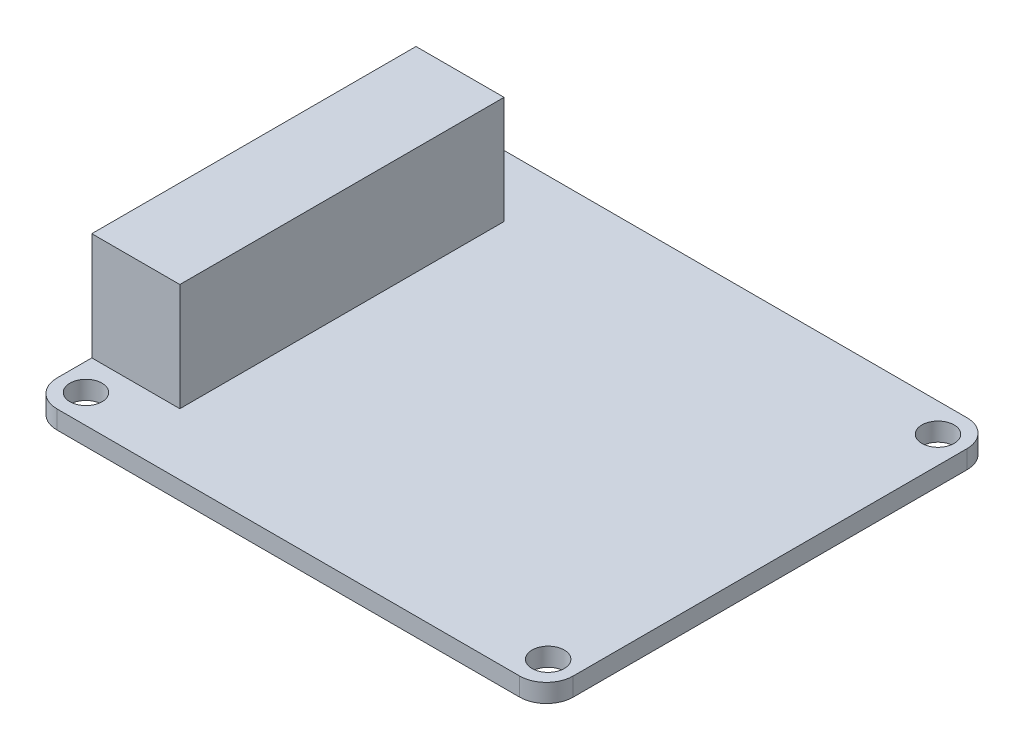
from build123d import *

# Parameters (mm, degrees)
SKETCH2_W           = 48.13
SKETCH2_H           = 41.71
BOSS_EXTRUDE1_DEPTH = 1.71
SKETCH3_R           = 1.5
CUT_EXTRUDE1_DEPTH  = 10.71
CUT_EXTRUDE2_DEPTH  = 10.71
FILLET3_R           = 2.5
SKETCH8_W           = 8.21
SKETCH8_H           = 30.23
BOSS_EXTRUDE2_DEPTH = 10.03


with BuildPart() as part:
    # Sketch2 → Boss-Extrude1 (new body)
    with BuildSketch(Plane(origin=(0, 0, 0), x_dir=(1, 0, 0), z_dir=(0, 1, 0))):
        Rectangle(SKETCH2_W, SKETCH2_H)
    extrude(amount=BOSS_EXTRUDE1_DEPTH)

    # Sketch3 → Cut-Extrude1 (cut)
    with BuildSketch(Plane(origin=(0, 1.71, 0), x_dir=(1, 0, 0), z_dir=(0, 1, 0))):
        with Locations(Location((-21.545702182, 18.174313444, 0), (0, 0, 270))):
            Circle(SKETCH3_R)
    cut_extrude1 = extrude(amount=-CUT_EXTRUDE1_DEPTH, mode=Mode.SUBTRACT)

    # Sketch4 → Cut-Extrude2 (cut)
    with BuildSketch(Plane(origin=(0, 1.71, 0), x_dir=(1, 0, 0), z_dir=(0, 1, 0))):
        with BuildLine():
            ThreePointArc((-20.045702182, -18.175), (-20.485042011, -17.114339828), (-21.545702182, -16.675))
            Line((-21.545702182, -16.675), (-21.545702182, -18.175))
            Line((-21.545702182, -18.175), (-21.545702182, -19.675))
            ThreePointArc((-21.545702182, -19.675), (-20.485042011, -19.235660172), (-20.045702182, -18.175))
        make_face()
        with BuildLine():
            Line((-21.545702182, -18.175), (-21.545702182, -16.675))
            ThreePointArc((-21.545702182, -16.675), (-23.045702182, -18.175), (-21.545702182, -19.675))
            Line((-21.545702182, -19.675), (-21.545702182, -18.175))
        make_face()
    cut_extrude2 = extrude(amount=-CUT_EXTRUDE2_DEPTH, mode=Mode.SUBTRACT)

    # Fillet3
    fillet3_edges = [part.edges().sort_by_distance(p)[0] for p in [
        (24.065, 0.855, 20.855),
        (-24.065, 0.855, 20.855),
        (-24.065, 0.855, -20.855),
        (24.065, 0.855, -20.855),
    ]]
    fillet(fillet3_edges, radius=FILLET3_R)

    # Mirror1: Cut-Extrude1, Cut-Extrude2 across plane
    add(cut_extrude1.mirror(Plane(origin=(0, 0, 0), x_dir=(0, 0, 1), z_dir=(1, 0, 0))), mode=Mode.SUBTRACT)
    add(cut_extrude2.mirror(Plane(origin=(0, 0, 0), x_dir=(0, 0, 1), z_dir=(1, 0, 0))), mode=Mode.SUBTRACT)

    # Sketch8 → Boss-Extrude2 (add)
    with BuildSketch(Plane(origin=(0, 1.71, 0), x_dir=(1, 0, 0), z_dir=(0, 1, 0))):
        with Locations((-19.96, 0)):
            Rectangle(SKETCH8_W, SKETCH8_H)
    extrude(amount=BOSS_EXTRUDE2_DEPTH)


solid = part.part
